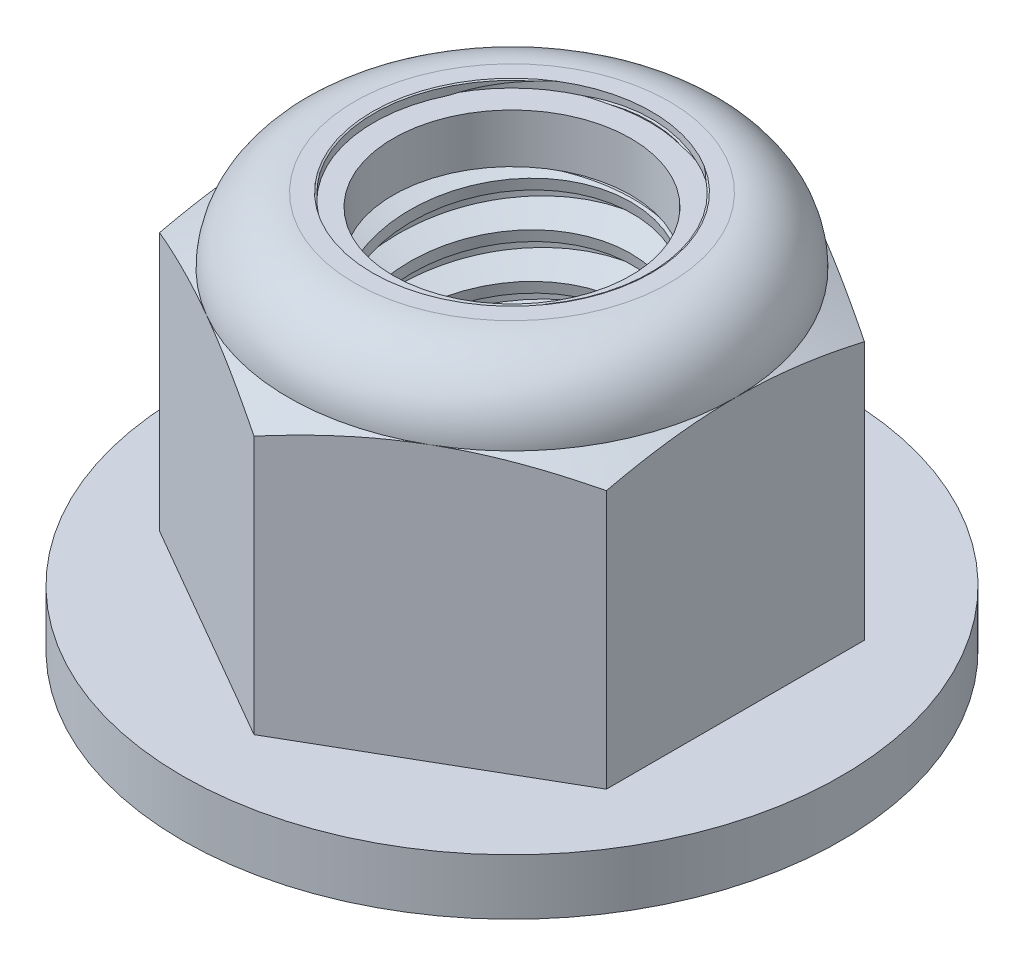
from build123d import *

# Parameters (mm, degrees)
EXTRUDE1_DEPTH      = 7.1
SKETCH8_W           = 5.9
SKETCH8_H           = 1
SKETCH2_W           = 2.5
SKETCH2_H           = 7.1
LPATTERN1_COUNT     = 9
LPATTERN1_PITCH     = 0.8
LPATTERN1_COL_COUNT = 2
LPATTERN1_COL_PITCH = 0.8


with BuildPart() as part:
    # Sketch1 → Extrude1 (new body)
    with BuildSketch(Plane(origin=(0, 0, 0), x_dir=(1, 0, 0), z_dir=(0, 1, 0))):
        Polygon((0, 4.618802154), (-4, 2.309401077), (-4, -2.309401077), (0, -4.618802154), (4, -2.309401077), (4, 2.309401077), align=None)
    extrude(amount=EXTRUDE1_DEPTH)

    # Sketch8 → Revolve3 (revolve)
    with BuildSketch(Plane(origin=(0, 0, 0), x_dir=(0, 0, -1), z_dir=(1, 0, 0)), mode=Mode.PRIVATE) as revolve3_sk:
        with Locations((2.95, 0.5)):
            Rectangle(SKETCH8_W, SKETCH8_H)
    revolve(revolve3_sk.sketch.rotate(Axis((0, 0, 0), (0, -1, 0)), 180), axis=Axis((0, 0, 0), (0, -1, 0)))

    # Sketch4 → Cut-Revolve2 (revolve, cut)
    with BuildSketch(Plane(origin=(0, 0, 0), x_dir=(0, 0, -1), z_dir=(1, 0, 0)), mode=Mode.PRIVATE) as cut_revolve2_sk:
        Polygon((0, 7.1), (2.5, 7.1), (2.127722339, 6.926404076), (2.127722339, 0.173595924), (2.5, 0), (0, 0), align=None)
    revolve(cut_revolve2_sk.sketch.rotate(Axis((0, 7.1, 0), (0, 1, 0)), 55.091745584), axis=Axis((0, 7.1, 0), (0, 1, 0)), mode=Mode.SUBTRACT)


with BuildPart() as body_2:
    # Sketch2 → Revolve1 (revolve)
    with BuildSketch(Plane(origin=(0, 0, 0), x_dir=(0, 0, -1), z_dir=(1, 0, 0))):
        with Locations((1.25, 3.55)):
            Rectangle(SKETCH2_W, SKETCH2_H)
    revolve(axis=Axis((0, -2.5, 0), (0, 1, 0)))

    # Sketch3 → Cut-Revolve1 (revolve, cut)
    with BuildSketch(Plane(origin=(0, 0, 0), x_dir=(0, 0, -1), z_dir=(1, 0, 0)), mode=Mode.PRIVATE) as cut_revolve1_sk:
        Polygon((2.51579905, 7.001255937), (2.626392401, 6.310047494), (2.15932044, 6.488495759), (2.127722339, 6.685983885), align=None)
    cut_revolve1 = revolve(cut_revolve1_sk.sketch.rotate(Axis((0, 7.1, 0.136915776), (0, -0.9874406319167053, -0.1579905011066731)), 180), axis=Axis((0, 7.1, 0.136915776), (0, -0.9874406319167053, -0.1579905011066731)), mode=Mode.SUBTRACT)

    # LPattern1: Cut-Revolve1 ×9
    with Locations(*[(0, -i * LPATTERN1_PITCH, 0) for i in range(1, LPATTERN1_COUNT)]):
        add(cut_revolve1, mode=Mode.SUBTRACT)

    # LPattern1 col: Cut-Revolve1 ×2
    with Locations(*[(0, i * LPATTERN1_COL_PITCH, 0) for i in range(1, LPATTERN1_COL_COUNT)]):
        add(cut_revolve1, mode=Mode.SUBTRACT)


with BuildPart() as part_1:
    add(part.part)

    # Combine1: cut body 2
    add(body_2.part, mode=Mode.SUBTRACT)

    # Sketch5 → Cut-Revolve3 (revolve, cut)
    with BuildSketch(Plane(origin=(0, 0, 0), x_dir=(0, 0, -1), z_dir=(1, 0, 0)), mode=Mode.PRIVATE) as cut_revolve3_sk:
        with BuildLine():
            Line((4.618802154, 1), (4.618802154, 5.628114484))
            Line((4.618802154, 5.628114484), (4, 5.916666667))
            ThreePointArc((4, 5.916666667), (3.653409691, 6.753409691), (2.816666667, 7.1))
            Line((2.816666667, 7.1), (2.816666667, 8.37))
            Line((2.816666667, 8.37), (5.888802154, 8.37))
            Line((5.888802154, 8.37), (5.888802154, 1))
            Line((5.888802154, 1), (4.618802154, 1))
        make_face()
    revolve(cut_revolve3_sk.sketch.rotate(Axis((0, 0, 0), (0, 1, 0)), 55.091745584), axis=Axis((0, 0, 0), (0, 1, 0)), mode=Mode.SUBTRACT)

    # Sketch6 → Cut-Revolve4 (revolve, cut)
    with BuildSketch(Plane(origin=(0, 0, 0), x_dir=(0, 0, -1), z_dir=(1, 0, 0)), mode=Mode.PRIVATE) as cut_revolve4_sk:
        with BuildLine():
            Line((0, 5.916666667), (3.8476, 5.916666667))
            ThreePointArc((3.8476, 5.916666667), (3.545646618, 6.645646618), (2.816666667, 6.9476))
            Line((2.816666667, 6.9476), (2.472194503, 6.9476))
            Line((2.472194503, 6.9476), (2.472194503, 8.37))
            Line((2.472194503, 8.37), (0, 8.37))
            Line((0, 8.37), (0, 5.916666667))
        make_face()
    revolve(cut_revolve4_sk.sketch.rotate(Axis((0, 8.37, 0), (0, 1, 0)), 55.091745584), axis=Axis((0, 8.37, 0), (0, 1, 0)), mode=Mode.SUBTRACT)


with BuildPart() as body_2_2:
    # Sketch7 → Revolve2 (revolve)
    with BuildSketch(Plane(origin=(0, 0, 0), x_dir=(0, 0, -1), z_dir=(1, 0, 0)), mode=Mode.PRIVATE) as revolve2_sk:
        with BuildLine():
            Line((2.127722339, 5.992866667), (3.768354272, 5.992866667))
            ThreePointArc((3.768354272, 5.992866667), (3.464264172, 6.618188733), (2.816666667, 6.8714))
            Line((2.816666667, 6.8714), (2.127722339, 6.8714))
            Line((2.127722339, 6.8714), (2.127722339, 5.992866667))
        make_face()
    revolve(revolve2_sk.sketch.rotate(Axis((0, 5.992866667, 0), (0, 1, 0)), 55.091745584), axis=Axis((0, 5.992866667, 0), (0, 1, 0)))


solid = Compound([part_1.part, body_2_2.part])
